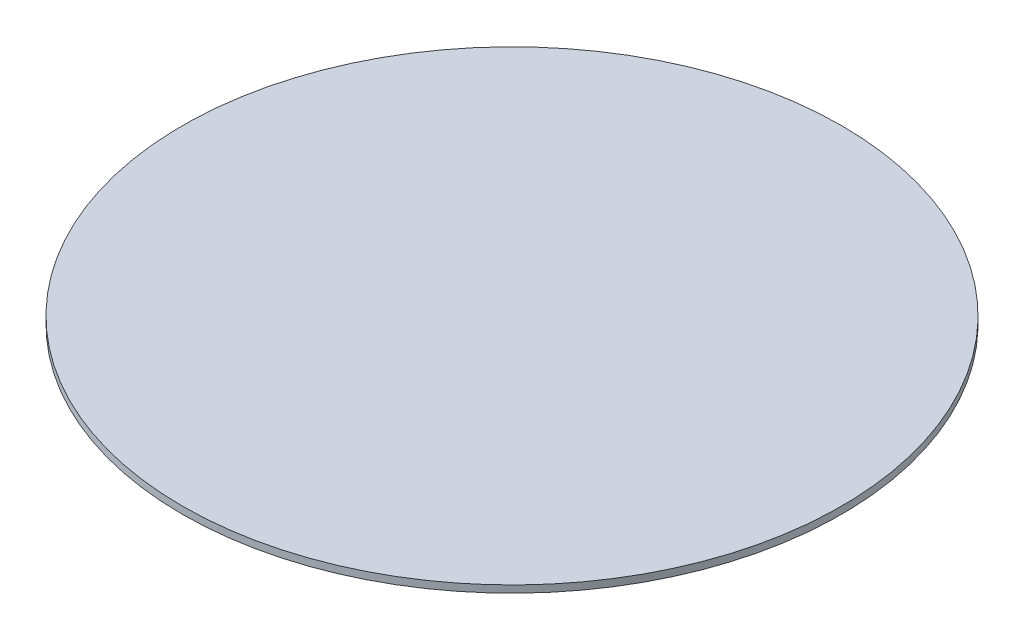
from build123d import *

# Parameters (mm, degrees)
SKETCH1_R           = 150
BOSS_EXTRUDE1_DEPTH = 3.25


with BuildPart() as part:
    # Sketch1 → Boss-Extrude1 (new body)
    with BuildSketch(Plane(origin=(0, 0, 0), x_dir=(1, 0, 0), z_dir=(0, 1, 0))):
        with Locations(Location((0, 0, 0), (0, 0, 90))):
            Circle(SKETCH1_R)
    extrude(amount=BOSS_EXTRUDE1_DEPTH)


solid = part.part
